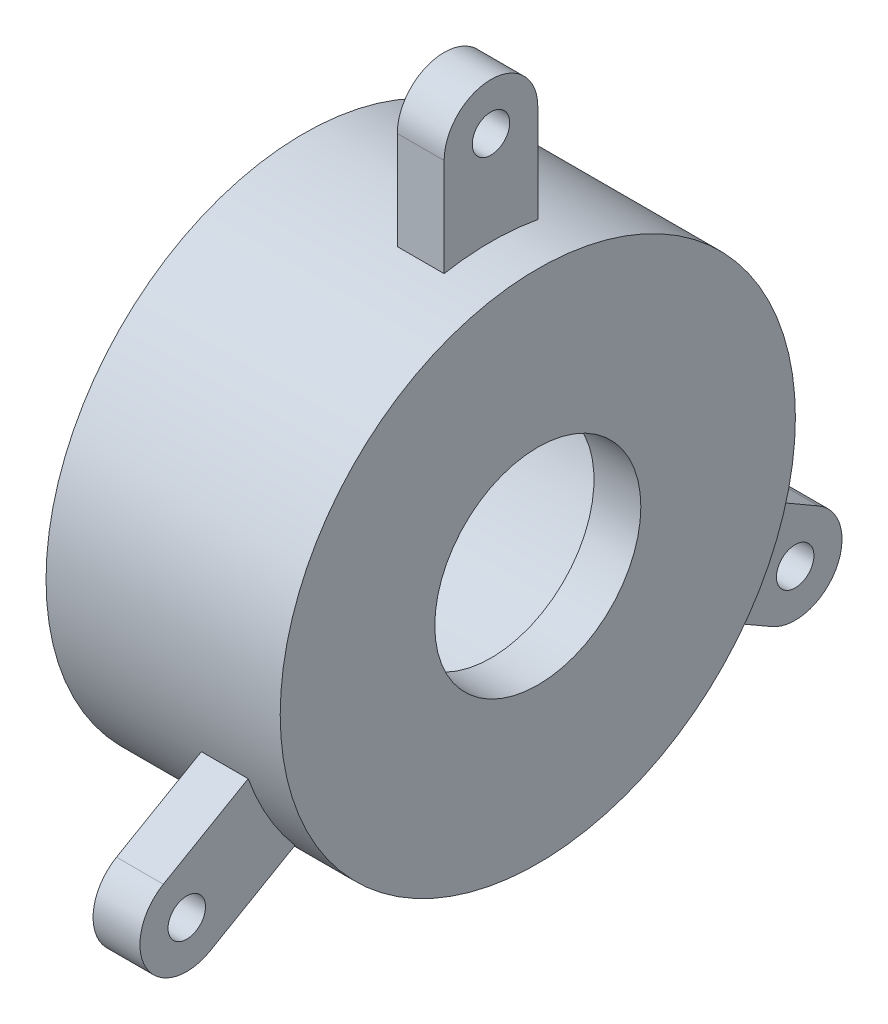
from build123d import *

# Parameters (mm, degrees)
BOSS_EXTRUDE1_START = -15
SKETCH4_R           = 4
BOSS_EXTRUDE1_DEPTH = 10
CIRPATTERN1_COUNT   = 3
SKETCH7_R           = 55
SKETCH7_R_2         = 22
CUT_EXTRUDE1_DEPTH  = 5


with BuildPart() as part:
    # Sketch3 → Revolve1 (revolve)
    with BuildSketch(Plane.XY, mode=Mode.PRIVATE) as revolve1_sk:
        Polygon((0, 40), (0, 55), (50, 55), (55, 55), (55, 52), (55, 22), (40, 22), (40, 40), align=None)
    revolve(revolve1_sk.sketch.rotate(Axis((-32.450781709, 0, 0), (1, 0, 0)), 90), axis=Axis((-32.450781709, 0, 0), (1, 0, 0)))

    # Sketch4 → Boss-Extrude1 (add)
    with BuildSketch(Plane(origin=(55, 0, 0), x_dir=(0, 0, -1), z_dir=(1, 0, 0)).offset(BOSS_EXTRUDE1_START)):
        with BuildLine():
            Line((10, 51.100551248), (10, 75))
            ThreePointArc((10, 75), (0, 85), (-10, 75))
            Line((-10, 75), (-10, 51.100551248))
            Line((-10, 51.100551248), (10, 51.100551248))
        make_face()
        with Locations((0, 75)):
            Circle(SKETCH4_R, mode=Mode.SUBTRACT)
    boss_extrude1 = extrude(amount=-BOSS_EXTRUDE1_DEPTH)

    # CirPattern1: Boss-Extrude1 ×3 about axis
    cirpattern1_axis = Axis((0, 0, 0), (1, 0, 0))
    for i in range(1, CIRPATTERN1_COUNT):
        add(boss_extrude1.rotate(cirpattern1_axis, i * 360 / CIRPATTERN1_COUNT))

    # Sketch7 → Cut-Extrude1 (cut)
    with BuildSketch(Plane(origin=(55, 0, 0), x_dir=(0, 0, -1), z_dir=(1, 0, 0))):
        with Locations(Location((0, 0, 0), (0, 0, 180))):
            Circle(SKETCH7_R)
        with Locations(Location((0, 0, 0), (0, 0, 180))):
            Circle(SKETCH7_R_2, mode=Mode.SUBTRACT)
    extrude(amount=-CUT_EXTRUDE1_DEPTH, mode=Mode.SUBTRACT)


solid = part.part
